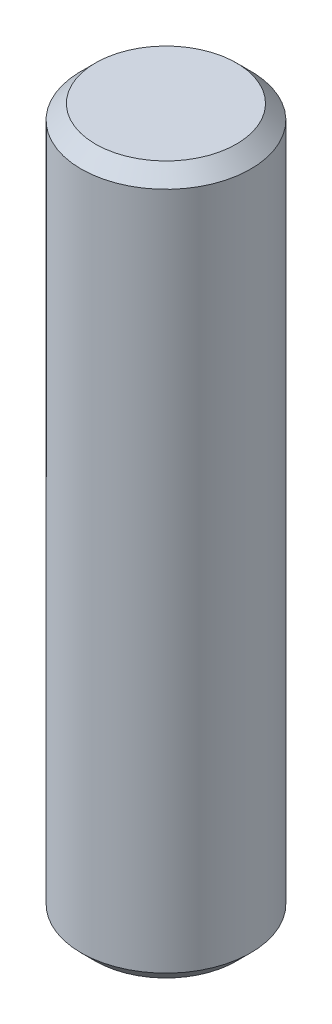
from build123d import *


with BuildPart() as part:
    # Sketch1 → Revolve1 (revolve)
    with BuildSketch(Plane(origin=(0, 0, 0), x_dir=(-1, 0, 0), z_dir=(0, 0, -1)), mode=Mode.PRIVATE) as revolve1_sk:
        Polygon((-2.48819, 0), (0, 0), (0, 25), (-2.48819, 25), (-2.99619, 24.492), (-2.99619, 0.508), align=None)
    revolve(revolve1_sk.sketch.rotate(Axis((0, 0, 0), (0, 1, 0)), 270), axis=Axis((0, 0, 0), (0, 1, 0)))


solid = part.part
